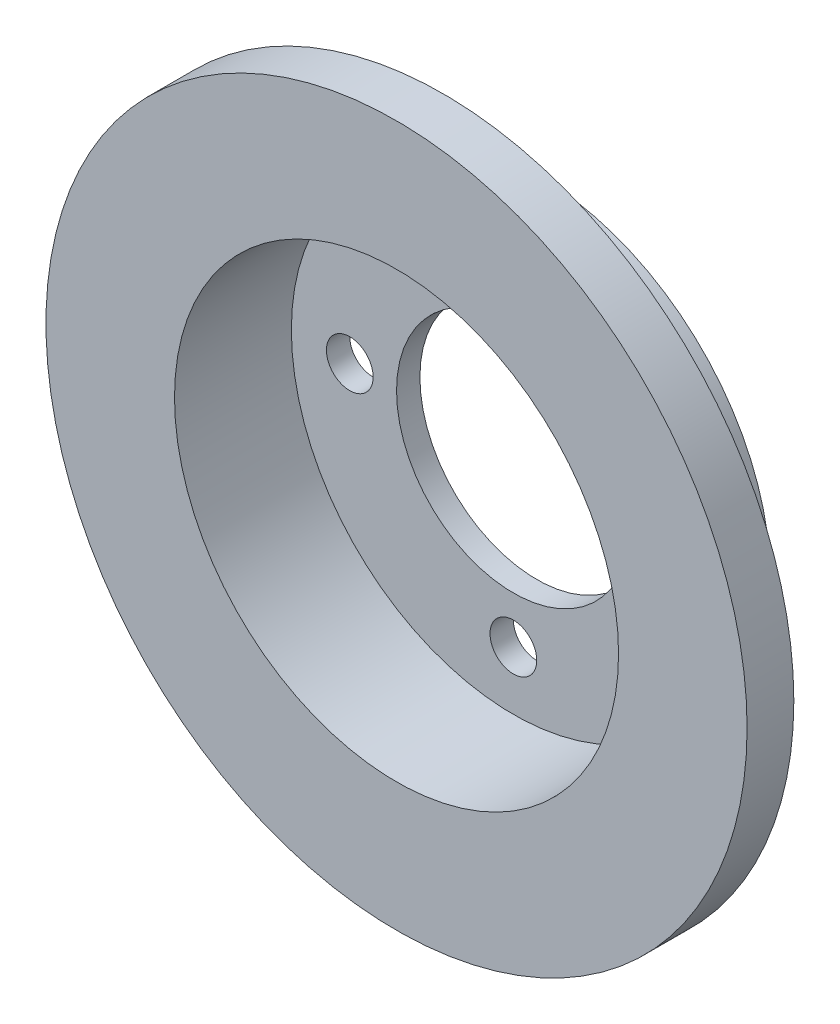
from build123d import *

# Parameters (mm, degrees)
SKETCH1_R           = 50
BOSS_EXTRUDE1_DEPTH = 20
SKETCH3_R           = 75
BOSS_EXTRUDE2_DEPTH = 10
SKETCH4_R           = 47.5
CUT_EXTRUDE3_DEPTH  = 25
SKETCH5_R           = 25
CUT_EXTRUDE4_DEPTH  = 25
SKETCH6_R           = 5
CUT_EXTRUDE5_DEPTH  = 25


with BuildPart() as part:
    # Sketch1 → Boss-Extrude1 (new body)
    with BuildSketch(Plane.XY):
        Circle(SKETCH1_R)
    extrude(amount=BOSS_EXTRUDE1_DEPTH)

    # Sketch3 → Boss-Extrude2 (add)
    with BuildSketch(Plane.XY.offset(20)):
        Circle(SKETCH3_R)
    extrude(amount=BOSS_EXTRUDE2_DEPTH)

    # Sketch4 → Cut-Extrude3 (cut)
    with BuildSketch(Plane.XY.offset(30)):
        Circle(SKETCH4_R)
    extrude(amount=-CUT_EXTRUDE3_DEPTH, mode=Mode.SUBTRACT)

    # Sketch5 → Cut-Extrude4 (cut)
    with BuildSketch(Plane.XY.offset(5)):
        Circle(SKETCH5_R)
    extrude(amount=-CUT_EXTRUDE4_DEPTH, mode=Mode.SUBTRACT)

    # Sketch6 → Cut-Extrude5 (cut)
    with BuildSketch(Plane.XY.offset(5)):
        with Locations((0, 35)):
            Circle(SKETCH6_R)
        with Locations((35, 0)):
            Circle(SKETCH6_R)
        with Locations((0, -35)):
            Circle(SKETCH6_R)
        with Locations((-35, 0)):
            Circle(SKETCH6_R)
    extrude(amount=-CUT_EXTRUDE5_DEPTH, mode=Mode.SUBTRACT)


solid = part.part
